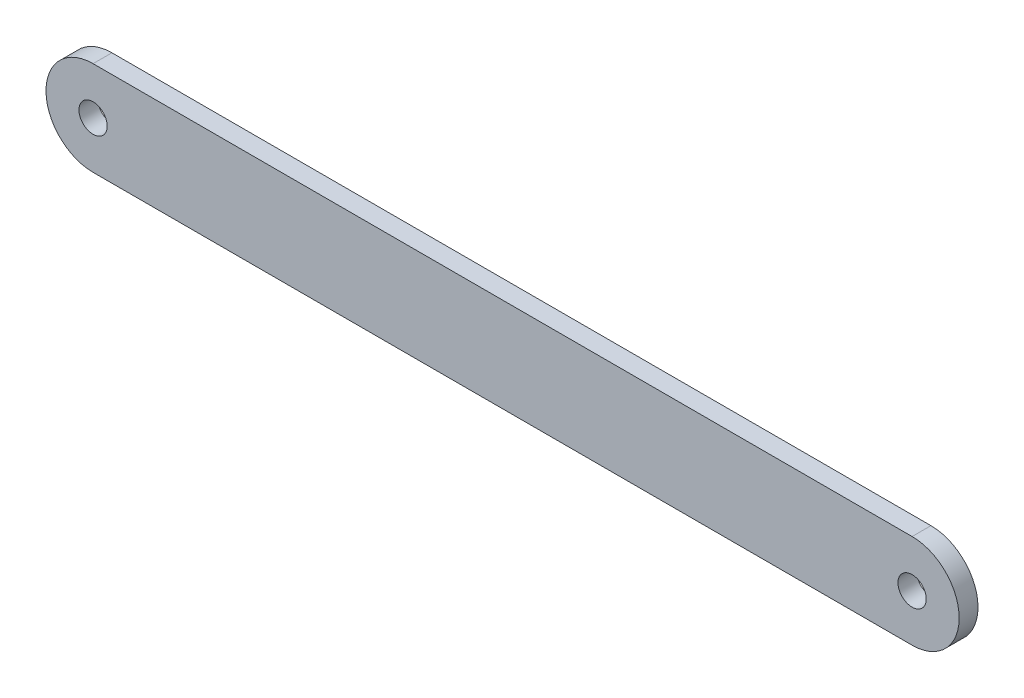
from build123d import *

# Parameters (mm, degrees)
ESQUISSE1_R        = 1.5
BOSS_EXTRU_1_DEPTH = 2


with BuildPart() as part:
    # Esquisse1 → Boss.-Extru.1 (new body)
    with BuildSketch(Plane.XY):
        with BuildLine():
            Line((-43.5, 5), (43.5, 5))
            ThreePointArc((43.5, 5), (48.5, 0), (43.5, -5))
            Line((43.5, -5), (-43.5, -5))
            ThreePointArc((-43.5, -5), (-48.5, 0), (-43.5, 5))
        make_face()
        with Locations((-43.5, 0)):
            Circle(ESQUISSE1_R, mode=Mode.SUBTRACT)
        with Locations((43.5, 0)):
            Circle(ESQUISSE1_R, mode=Mode.SUBTRACT)
    extrude(amount=BOSS_EXTRU_1_DEPTH)


solid = part.part
